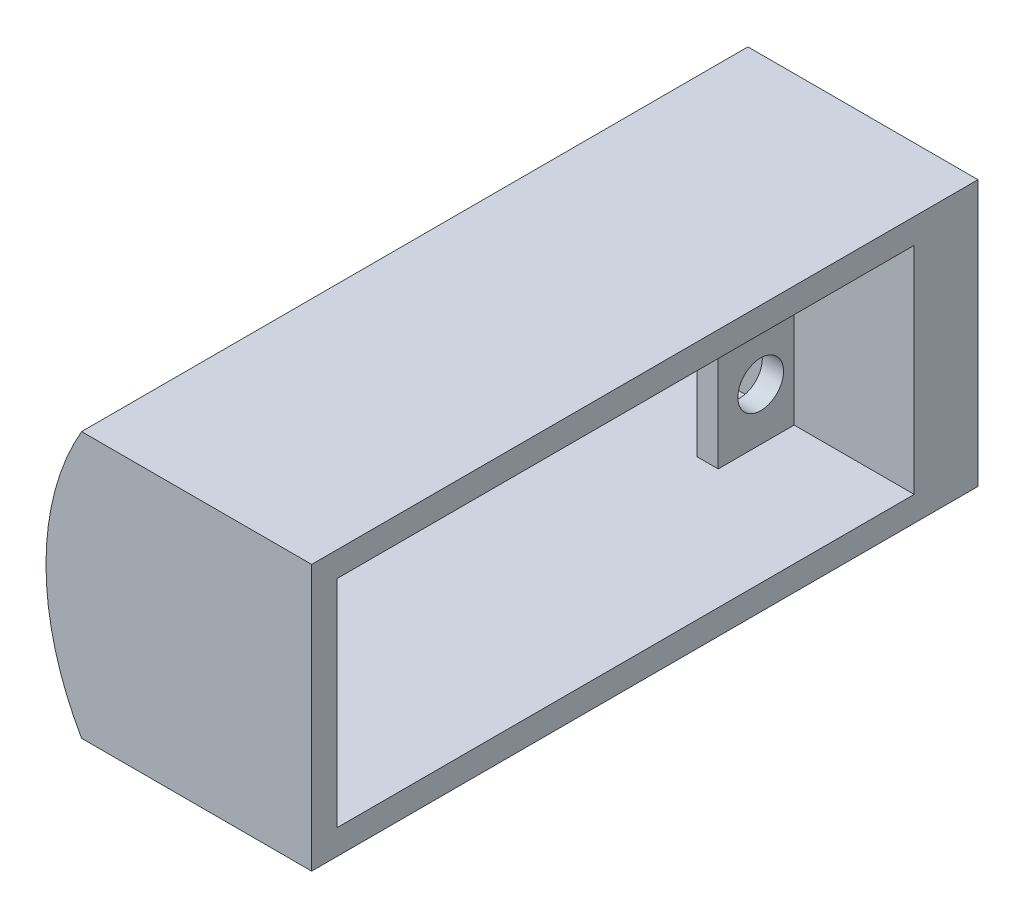
from build123d import *

# Parameters (mm, degrees)
SKETCH1_R               = 25
SKETCH1_W               = 27.5
SKETCH1_H               = 27.5
BOSS_EXTRUDE1_DEPTH     = 55
BOSS_EXTRUDE2_START     = 5
SKETCH2_R               = 25
BOSS_EXTRUDE2_DEPTH     = 5
SKETCH3_W               = 25
SKETCH3_H               = 50
BOSS_EXTRUDE3_DEPTH     = 80
FILLET1_R               = 2.5
FILLET2_R               = 2.5
SKETCH21_W              = 54.3
SKETCH21_H              = 20.3
CUT_EXTRUDE1_DEPTH      = 11.3
SKETCH22_W              = 40.3
SKETCH22_H              = 20.3
CUT_EXTRUDE2_DEPTH      = 93.059763198
CUT_EXTRUDE3_DEPTH      = 88.464278423
SKETCH23_R              = 2.15
CUT_EXTRUDE4_DEPTH      = 93.059763198
CUT_EXTRUDE7_DEPTH      = 27.5
CUT_EXTRUDE8_DEPTH      = 93.059763198
CUT_EXTRUDE8_DEPTH_BACK = 93.059763198
SKETCH25_W              = 77.291444149
SKETCH25_H              = 50
CUT_EXTRUDE9_DEPTH      = 93.059763198
CUT_EXTRUDE9_DEPTH_BACK = 93.059763198
SKETCH26_W              = 62.708555851
SKETCH26_H              = 12.5


with BuildPart() as part:
    # Sketch1 → Boss-Extrude1 (new body)
    with BuildSketch(Plane.XY):
        Circle(SKETCH1_R)
        Rectangle(SKETCH1_W, SKETCH1_H, mode=Mode.SUBTRACT)
    extrude(amount=BOSS_EXTRUDE1_DEPTH)

    # Sketch2 → Boss-Extrude2 (add)
    with BuildSketch(Plane(origin=(0, 0, 0), x_dir=(-1, 0, 0), z_dir=(0, 0, -1)).offset(BOSS_EXTRUDE2_START)):
        Circle(SKETCH2_R)
    extrude(amount=-BOSS_EXTRUDE2_DEPTH)

    # Sketch3 → Boss-Extrude3 (add)
    with BuildSketch(Plane(origin=(0, 0, -5), x_dir=(-1, 0, 0), z_dir=(0, 0, -1))):
        with Locations((12.5, 0)):
            Rectangle(SKETCH3_W, SKETCH3_H)
    extrude(amount=BOSS_EXTRUDE3_DEPTH)

    # Fillet1
    fillet1_edges = [part.edges().sort_by_distance(p)[0] for p in [
        (-13.75, 13.75, 27.5),
        (13.75, 13.75, 27.5),
        (-13.75, -13.75, 27.5),
        (13.75, -13.75, 27.5),
    ]]
    fillet(fillet1_edges, radius=FILLET1_R)

    # Fillet2
    fillet2_edges = [part.edges().sort_by_distance(p)[0] for p in [
        (13.75, 0, 55),
    ]]
    fillet(fillet2_edges, radius=FILLET2_R)

    # Sketch21 → Cut-Extrude1 (cut)
    with BuildSketch(Plane(origin=(0, 0, 0), x_dir=(0, 0, -1), z_dir=(1, 0, 0))):
        with Locations((51.85, 0)):
            Rectangle(SKETCH21_W, SKETCH21_H)
    extrude(amount=-CUT_EXTRUDE1_DEPTH, mode=Mode.SUBTRACT)

    # Sketch22 → Cut-Extrude2 (cut, through all)
    with BuildSketch(Plane(origin=(0, 0, 0), x_dir=(0, 0, -1), z_dir=(1, 0, 0))):
        with Locations((51.7, 0)):
            Rectangle(SKETCH22_W, SKETCH22_H)
    extrude(amount=-CUT_EXTRUDE2_DEPTH, mode=Mode.SUBTRACT)

    # Sketch18 → Cut-Extrude3 (cut, through all)
    with BuildSketch(Plane.XY.offset(-5)):
        with BuildLine():
            Line((-25, -25), (0, -25))
            ThreePointArc((0, -25), (-17.67766953, -17.67766953), (-25, 0))
            Line((-25, 0), (-25, -25))
        make_face()
        with BuildLine():
            Line((-25, 25), (-25, 0))
            ThreePointArc((-25, 0), (-17.67766953, 17.67766953), (0, 25))
            Line((0, 25), (-25, 25))
        make_face()
    extrude(amount=-CUT_EXTRUDE3_DEPTH, mode=Mode.SUBTRACT)

    # Sketch23 → Cut-Extrude4 (cut, through all)
    with BuildSketch(Plane(origin=(0, 0, 0), x_dir=(0, 0, -1), z_dir=(1, 0, 0))):
        with Locations((75.85, 5.25)):
            Circle(SKETCH23_R)
        with Locations((75.85, -5.25)):
            Circle(SKETCH23_R)
        with Locations((27.85, 5.25)):
            Circle(SKETCH23_R)
        with Locations((27.85, -5.25)):
            Circle(SKETCH23_R)
    extrude(amount=-CUT_EXTRUDE4_DEPTH, mode=Mode.SUBTRACT)

    # Sketch24 → Cut-Extrude7 (cut, symmetric)
    with BuildSketch(Plane(origin=(0, 0, -51.7), x_dir=(-1, 0, 0), z_dir=(0, 0, -1))):
        with BuildLine():
            Line((13.3, 10.15), (13.3, -10.15))
            Line((13.3, -10.15), (22.846826913, -10.15))
            ThreePointArc((22.846826913, -10.15), (25, 0), (22.846826913, 10.15))
            Line((22.846826913, 10.15), (13.3, 10.15))
        make_face()
    extrude(amount=CUT_EXTRUDE7_DEPTH, both=True, mode=Mode.SUBTRACT)

    # Sketch25 → Cut-Extrude8 (cut, two sides: drawn at the far end of the back side and taken through both)
    with BuildSketch(Plane(origin=(0, 0, 0), x_dir=(0, 0, -1), z_dir=(1, 0, 0)).offset(-CUT_EXTRUDE8_DEPTH_BACK)):
        with Locations((-16.354277925, 0)):
            Rectangle(SKETCH25_W, SKETCH25_H)
    extrude(amount=CUT_EXTRUDE8_DEPTH + CUT_EXTRUDE8_DEPTH_BACK, mode=Mode.SUBTRACT)

    # Sketch26 → Cut-Extrude9 (cut, two sides: drawn at the far end of the back side and taken through both)
    with BuildSketch(Plane(origin=(0, 0, 0), x_dir=(0, 0, -1), z_dir=(1, 0, 0)).offset(-CUT_EXTRUDE9_DEPTH_BACK)):
        with Locations((53.645722075, 18.75)):
            Rectangle(SKETCH26_W, SKETCH26_H)
        with Locations((53.645722075, -18.75)):
            Rectangle(SKETCH26_W, SKETCH26_H)
    extrude(amount=CUT_EXTRUDE9_DEPTH + CUT_EXTRUDE9_DEPTH_BACK, mode=Mode.SUBTRACT)


solid = part.part
